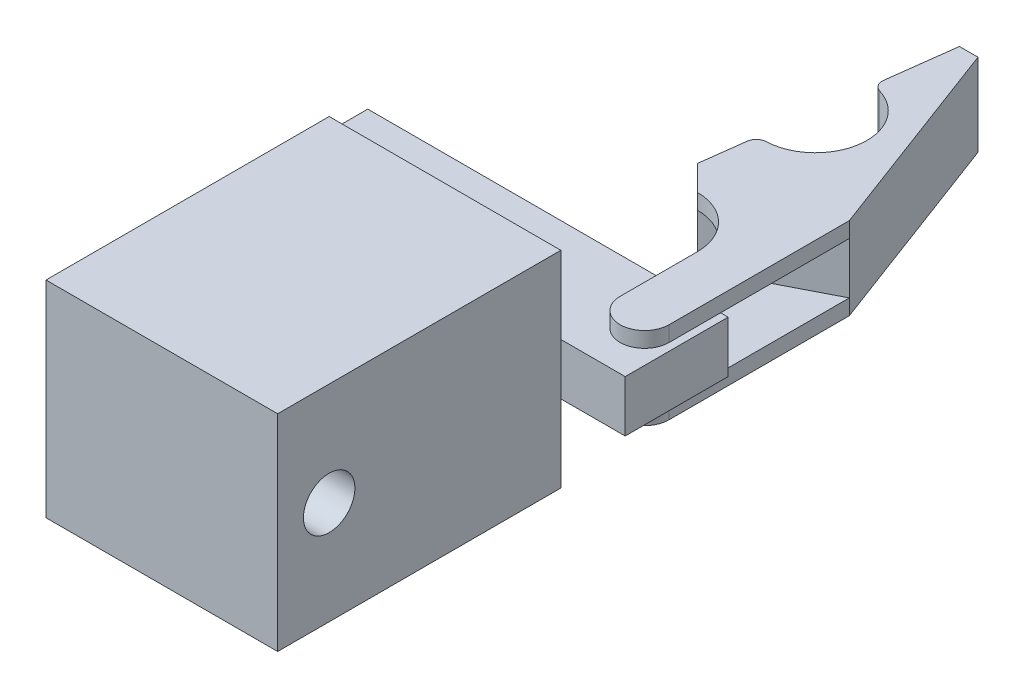
from build123d import *

# Parameters (mm, degrees)
SKETCH1_W           = 45
SKETCH1_H           = 55
BOSS_EXTRUDE1_DEPTH = 40
SKETCH2_R           = 5
CUT_EXTRUDE1_DEPTH  = 45
SKETCH3_W           = 70
SKETCH3_H           = 10
BOSS_EXTRUDE2_DEPTH = 20
SKETCH6_R           = 1.5
CUT_EXTRUDE3_DEPTH  = 10
BOSS_EXTRUDE4_DEPTH = 3
BOSS_EXTRUDE5_START = 10
BOSS_EXTRUDE5_DEPTH = 10


with BuildPart() as part:
    # Sketch1 → Boss-Extrude1 (new body)
    with BuildSketch(Plane(origin=(0, 0, 0), x_dir=(1, 0, 0), z_dir=(0, 1, 0))):
        Rectangle(SKETCH1_W, SKETCH1_H)
    extrude(amount=BOSS_EXTRUDE1_DEPTH)

    # Sketch2 → Cut-Extrude1 (cut)
    with BuildSketch(Plane(origin=(22.5, 0, 0), x_dir=(0, 0, -1), z_dir=(1, 0, 0))):
        with Locations((-17.5, 20)):
            Circle(SKETCH2_R)
    extrude(amount=-CUT_EXTRUDE1_DEPTH, mode=Mode.SUBTRACT)

    # Sketch3 → Boss-Extrude2 (add)
    with BuildSketch(Plane(origin=(0, 0, -27.5), x_dir=(-1, 0, 0), z_dir=(0, 0, -1))):
        with Locations((0, 20)):
            Rectangle(SKETCH3_W, SKETCH3_H)
    extrude(amount=BOSS_EXTRUDE2_DEPTH)

    # Sketch6 → Cut-Extrude3 (cut)
    with BuildSketch(Plane(origin=(0, 25, 0), x_dir=(1, 0, 0), z_dir=(0, 1, 0))):
        with Locations(Location((28.771358024, 37.5, 0), (0, 0, 180))):
            Circle(SKETCH6_R)
        with Locations(Location((-27.782656664, 37.5, 0), (0, 0, 180))):
            Circle(SKETCH6_R)
    extrude(amount=-CUT_EXTRUDE3_DEPTH, mode=Mode.SUBTRACT)

    # Sketch7 → Boss-Extrude4 (add)
    with BuildSketch(Plane(origin=(0, 25, 0), x_dir=(1, 0, 0), z_dir=(0, 1, 0))):
        with BuildLine():
            Line((18.533858024, 112.5), (14.933858024, 112.5))
            Line((14.933858024, 112.5), (13.262014547, 99.438722839))
            ThreePointArc((13.262014547, 99.438722839), (13.566755729, 98.09818866), (14.664816743, 97.271048355))
            ThreePointArc((14.664816743, 97.271048355), (21.67882772, 86.432675937), (12.161050226, 77.710372444))
            ThreePointArc((12.161050226, 77.710372444), (10.890055897, 77.186471223), (10.257494727, 75.965911745))
            Line((10.257494727, 75.965911745), (9.15513462, 67.353723404))
            Line((9.15513462, 67.353723404), (14.008858024, 62.5))
            ThreePointArc((14.008858024, 62.5), (21.079925836, 59.571067812), (24.008858024, 52.5))
            Line((24.008858024, 52.5), (24.008858024, 37.5))
            ThreePointArc((24.008858024, 37.5), (25.403761978, 34.132403955), (28.771358024, 32.7375))
            ThreePointArc((28.771358024, 32.7375), (32.138954069, 34.132403955), (33.533858024, 37.5))
            Line((33.533858024, 37.5), (33.533858024, 72.5))
            Line((33.533858024, 72.5), (18.533858024, 112.5))
        make_face()
    boss_extrude4 = extrude(amount=BOSS_EXTRUDE4_DEPTH)

    # Sketch8 → Boss-Extrude5 (add)
    with BuildSketch(Plane.XZ.offset(-25).offset(BOSS_EXTRUDE5_START)):
        with BuildLine():
            Line((33.533858024, -72.5), (14.008858024, -62.5))
            Line((14.008858024, -62.5), (9.15513462, -67.353723404))
            Line((9.15513462, -67.353723404), (10.257494727, -75.965911745))
            ThreePointArc((10.257494727, -75.965911745), (10.890055897, -77.186471223), (12.161050226, -77.710372444))
            ThreePointArc((12.161050226, -77.710372444), (21.67882772, -86.432675937), (14.664816743, -97.271048355))
            ThreePointArc((14.664816743, -97.271048355), (13.566755729, -98.09818866), (13.262014547, -99.438722839))
            Line((13.262014547, -99.438722839), (14.933858024, -112.5))
            Line((14.933858024, -112.5), (18.533858024, -112.5))
            Line((18.533858024, -112.5), (33.533858024, -72.5))
        make_face()
    extrude(amount=-BOSS_EXTRUDE5_DEPTH)

    # Mirror1: Boss-Extrude4 across plane
    add(boss_extrude4.mirror(Plane.ZX.offset(20)))


solid = part.part
